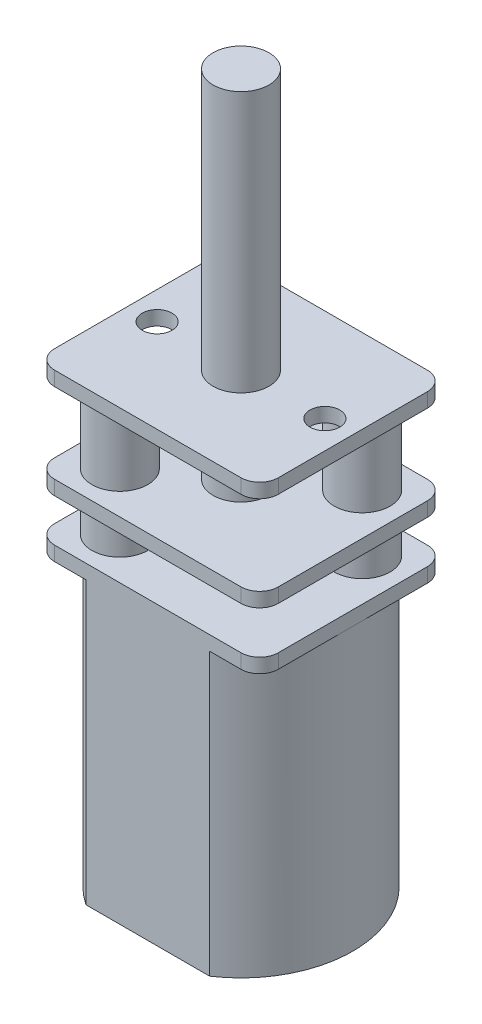
from build123d import *

# Parameters (mm, degrees)
SKETCH_1_W          = 12
SKETCH_1_H          = 10
EXTRUDE_1_DEPTH     = 24
FILLET_1_R          = 1
CUT_EXTRUDE_START   = -15.1
SKETCH_2_OUTSIDE_W  = 19.728
SKETCH_2_OUTSIDE_H  = 17.728
CUT_EXTRUDE_1_DEPTH = 15.1
SKETCH_3_R          = 1.5
EXTRUDE_2_DEPTH     = 14
SKETCH_5_R          = 2.5
EXTRUDE_3_DEPTH     = 1.25
SKETCH_6_W          = 20
SKETCH_6_H          = 4.3
SKETCH_6_H_2        = 2.29
CUT_EXTRUDE_2_REACH = 28.43
SKETCH_4_R          = 0.8
EXTRUDE_START       = -8.13
EXTRUDE_4_DEPTH     = 7.36


with BuildPart() as part:
    # 草图1 → 凸台-拉伸1 (new body)
    with BuildSketch(Plane(origin=(0, 0, 0), x_dir=(1, 0, 0), z_dir=(0, 1, 0))):
        Rectangle(SKETCH_1_W, SKETCH_1_H)
    extrude(amount=EXTRUDE_1_DEPTH)

    # 圆角1
    fillet_1_edges = [part.edges().sort_by_distance(p)[0] for p in [
        (6, 12, 5),
        (-6, 12, 5),
        (-6, 12, -5),
        (6, 12, -5),
    ]]
    fillet(fillet_1_edges, radius=FILLET_1_R)

    # 草图2 outside → 切除-拉伸1 (cut)
    with BuildSketch(Plane.XZ.offset(CUT_EXTRUDE_START)):
        Rectangle(SKETCH_2_OUTSIDE_W, SKETCH_2_OUTSIDE_H)
        with BuildLine():
            Line((-3.31662479, -5), (3.31662479, -5))
            ThreePointArc((3.31662479, -5), (5.286764074, -2.837274331), (6, 0))
            ThreePointArc((6, 0), (5.286764074, 2.837274331), (3.31662479, 5))
            Line((3.31662479, 5), (-3.31662479, 5))
            ThreePointArc((-3.31662479, 5), (-5.286764074, 2.837274331), (-6, 0))
            ThreePointArc((-6, 0), (-5.286764074, -2.837274331), (-3.31662479, -5))
        make_face(mode=Mode.SUBTRACT)
    extrude(amount=CUT_EXTRUDE_1_DEPTH, mode=Mode.SUBTRACT)

    # 草图3 → 凸台-拉伸2 (add)
    with BuildSketch(Plane(origin=(0, 24, 0), x_dir=(1, 0, 0), z_dir=(0, 1, 0))):
        with Locations(Location((0, 0, 0), (0, 0, 270))):
            Circle(SKETCH_3_R)
    extrude(amount=EXTRUDE_2_DEPTH)

    # 草图5 → 凸台-拉伸3 (add)
    with BuildSketch(Plane.XZ):
        with Locations(Location((0, 0, 0), (0, 0, 270))):
            Circle(SKETCH_5_R)
    extrude(amount=EXTRUDE_3_DEPTH)

    # 草图6 → 切除-旋转3 (revolve, cut)
    with BuildSketch(Plane.XY, mode=Mode.PRIVATE) as cut_revolve_3_sk:
        with Locations((11.5, 21.08)):
            Rectangle(SKETCH_6_W, SKETCH_6_H)
        with Locations((11.5, 17.015)):
            Rectangle(SKETCH_6_W, SKETCH_6_H_2)
    revolve(cut_revolve_3_sk.sketch.rotate(Axis((0, 38, 0), (0, -1, 0)), 90), axis=Axis((0, 38, 0), (0, -1, 0)), mode=Mode.SUBTRACT)

    # 草图4 → 切除-拉伸2 (cut, up to next)
    with BuildSketch(Plane(origin=(0, 24, 0), x_dir=(1, 0, 0), z_dir=(0, 1, 0)), mode=Mode.PRIVATE) as cut_extrude_2_sk1:
        with Locations(Location((-4.5, 0, 0), (0, 0, 270))):
            Circle(SKETCH_4_R)
    cut_extrude_2_tool1 = extrude(cut_extrude_2_sk1.sketch, amount=-CUT_EXTRUDE_2_REACH, mode=Mode.PRIVATE) & part.part
    # 草图4 → 切除-拉伸2 (cut, up to next)
    with BuildSketch(Plane(origin=(0, 24, 0), x_dir=(1, 0, 0), z_dir=(0, 1, 0)), mode=Mode.PRIVATE) as cut_extrude_2_sk2:
        with Locations(Location((4.5, 0, 0), (0, 0, 270))):
            Circle(SKETCH_4_R)
    cut_extrude_2_tool2 = extrude(cut_extrude_2_sk2.sketch, amount=-CUT_EXTRUDE_2_REACH, mode=Mode.PRIVATE) & part.part
    add(cut_extrude_2_tool1.solids().sort_by_distance((-4.5, 24, 0))[0], mode=Mode.SUBTRACT)
    add(cut_extrude_2_tool2.solids().sort_by_distance((4.5, 24, 0))[0], mode=Mode.SUBTRACT)

    # 草图7 → 凸台-拉伸4 (add)
    with BuildSketch(Plane(origin=(0, 24, 0), x_dir=(1, 0, 0), z_dir=(0, 1, 0)).offset(EXTRUDE_START)):
        with BuildLine():
            ThreePointArc((3.75, 1.25), (4.810660172, 1.689339828), (5.25, 2.75))
            ThreePointArc((5.25, 2.75), (4.810660174, 3.81066017), (3.750000005, 4.25))
            ThreePointArc((3.750000005, 4.25), (2.68933983, 3.810660174), (2.25, 2.75))
            Line((2.25, 2.75), (3.75, 2.75))
            Line((3.75, 2.75), (3.75, 1.25))
        make_face()
        with BuildLine():
            ThreePointArc((2.25, 2.75), (2.689339828, 1.689339828), (3.75, 1.25))
            Line((3.75, 1.25), (3.75, 2.75))
            Line((3.75, 2.75), (2.25, 2.75))
        make_face()
        with BuildLine():
            ThreePointArc((-5.25, -2.750000006), (-4.810660171, -3.810660173), (-3.750000004, -4.25))
            ThreePointArc((-3.750000004, -4.25), (-2.68933983, -3.810660173), (-2.25, -2.75))
            Line((-2.25, -2.75), (-3.75, -2.75))
            Line((-3.75, -2.75), (-3.75, -1.25))
            ThreePointArc((-3.75, -1.25), (-4.810660174, -1.68933983), (-5.25, -2.750000006))
        make_face()
        with BuildLine():
            Line((-3.75, -2.75), (-2.25, -2.75))
            ThreePointArc((-2.25, -2.75), (-2.689339828, -1.689339828), (-3.75, -1.25))
            Line((-3.75, -1.25), (-3.75, -2.75))
        make_face()
    extrude(amount=EXTRUDE_4_DEPTH)


solid = part.part
